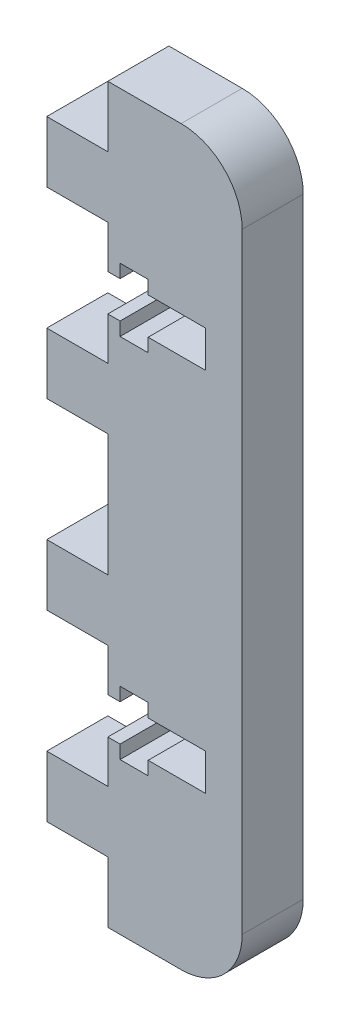
from build123d import *

# Parameters (mm, degrees)
BOSS_EXTRUDE1_DEPTH = 5
FILLET1_R           = 5


with BuildPart() as part:
    # Sketch1 → Boss-Extrude1 (new body)
    with BuildSketch(Plane.XY):
        Polygon((0, 60), (0, 55), (-5, 55), (-5, 50), (0, 50), (0, 46.5), (1, 46.5), (1, 47.6), (3.3, 47.6), (3.3, 46.5), (8, 46.5), (8, 43.5), (3.3, 43.5), (3.3, 42.4), (1, 42.4), (1, 43.5), (0, 43.5), (0, 40), (-5, 40), (-5, 35), (0, 35), (0, 25), (-5, 25), (-5, 20), (0, 20), (0, 16.5), (1, 16.5), (1, 17.6), (3.3, 17.6), (3.3, 16.5), (8, 16.5), (8, 13.5), (3.3, 13.5), (3.3, 12.4), (1, 12.4), (1, 13.5), (0, 13.5), (0, 10), (-5, 10), (-5, 5), (0, 5), (0, 0), (11, 0), (11, 60), align=None)
    extrude(amount=BOSS_EXTRUDE1_DEPTH)

    # Fillet1
    fillet1_edges = [part.edges().sort_by_distance(p)[0] for p in [
        (11, 60, 2.5),
        (11, 0, 2.5),
    ]]
    fillet(fillet1_edges, radius=FILLET1_R)


solid = part.part
